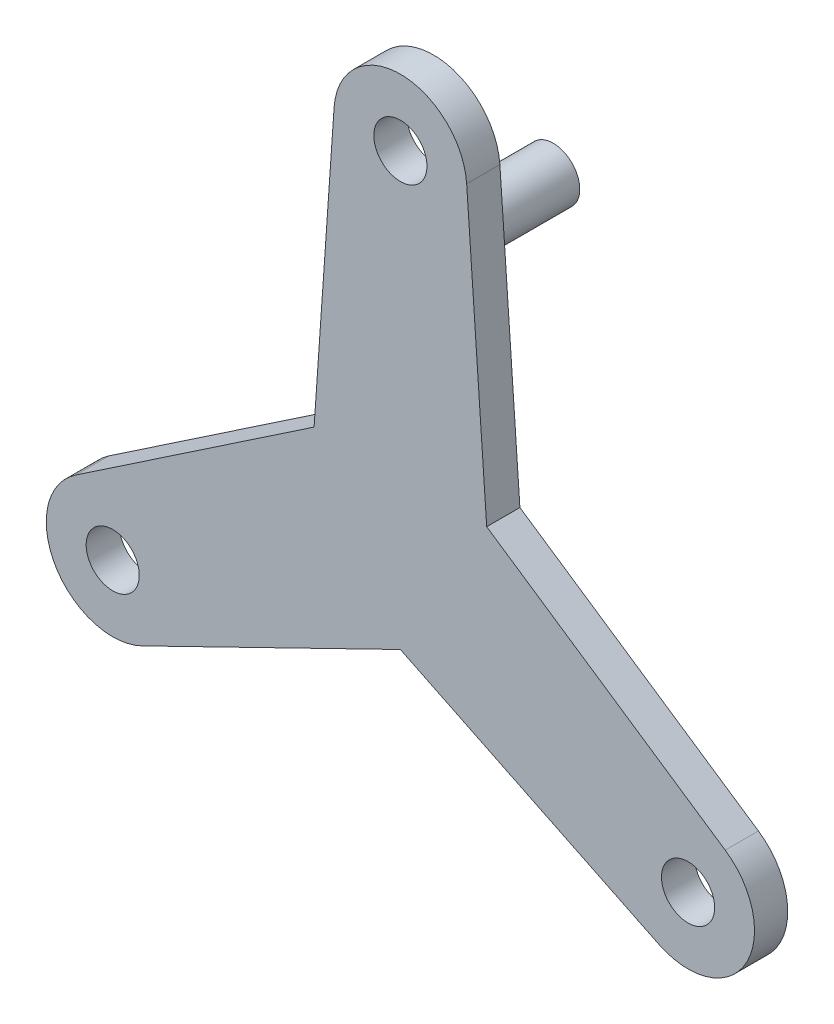
from build123d import *

# Parameters (mm, degrees)
BOSS_EXTRUDE1_DEPTH = 5
SKETCH3_R           = 4
CUT_EXTRUDE1_DEPTH  = 5
SKETCH4_R           = 4
PEG_DEPTH           = 18


with BuildPart() as part:
    # Sketch1 → Boss-Extrude1 (new body)
    with BuildSketch(Plane.XY):
        with BuildLine():
            Line((-38.916331436, -83.987341772), (0, -65))
            Line((0, -65), (38.916331436, -83.987341772))
            ThreePointArc((38.916331436, -83.987341772), (51.961524227, -80), (48.8920671, -66.708860759))
            Line((48.8920671, -66.708860759), (12.990381057, -42.5))
            Line((12.990381057, -42.5), (9.975735664, 0.696202532))
            ThreePointArc((9.975735664, 0.696202532), (0, 10), (-9.975735664, 0.696202532))
            Line((-9.975735664, 0.696202532), (-12.990381057, -42.5))
            Line((-12.990381057, -42.5), (-48.8920671, -66.708860759))
            ThreePointArc((-48.8920671, -66.708860759), (-51.961524227, -80), (-38.916331436, -83.987341772))
        make_face()
    extrude(amount=BOSS_EXTRUDE1_DEPTH)

    # Sketch3 → Cut-Extrude1 (cut)
    with BuildSketch(Plane(origin=(0, 0, 0), x_dir=(-1, 0, 0), z_dir=(0, 0, -1))):
        with Locations((0, 30)):
            Circle(SKETCH3_R)
        Circle(SKETCH3_R)
        with Locations((-43.301270189, -75)):
            Circle(SKETCH3_R)
        with Locations((43.301270189, -75)):
            Circle(SKETCH3_R)
    extrude(amount=-CUT_EXTRUDE1_DEPTH, mode=Mode.SUBTRACT)

    # Sketch4 → peg (add)
    with BuildSketch(Plane(origin=(0, 0, 0), x_dir=(-1, 0, 0), z_dir=(0, 0, -1))):
        with Locations((0, -14.5)):
            Circle(SKETCH4_R)
    extrude(amount=PEG_DEPTH)


solid = part.part
